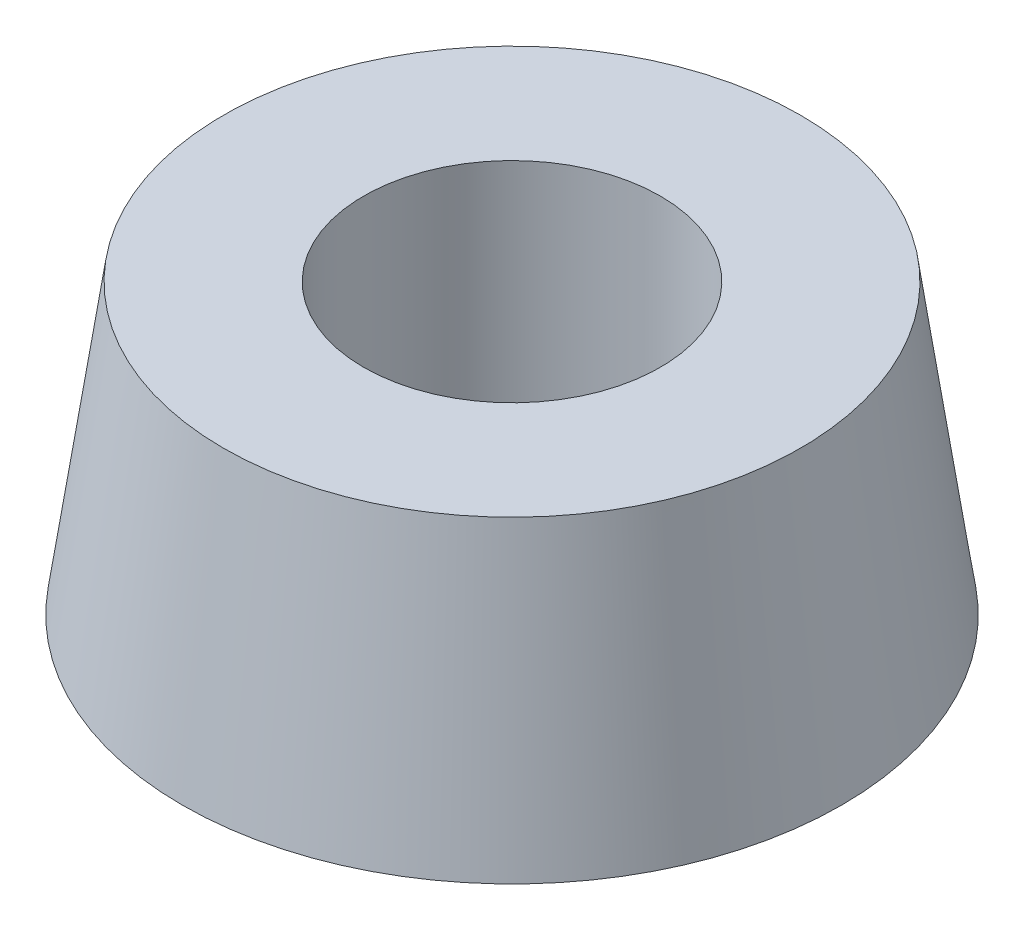
from build123d import *

# Parameters (mm, degrees)
SKETCH_1_R          = 12
SKETCH_2_R          = 10.5
SKETCH_4_R          = 5.4
CUT_EXTRUDE_1_DEPTH = 20.956202216


with BuildPart() as part:
    # 草图1 → 放样1 section 0
    with BuildSketch(Plane(origin=(0, 0, 0), x_dir=(1, 0, 0), z_dir=(0, 1, 0))):
        Circle(SKETCH_1_R)
    # 草图2 → 放样1 section 1
    with BuildSketch(Plane(origin=(0, 10.5, 0), x_dir=(1, 0, 0), z_dir=(0, 1, 0))):
        Circle(SKETCH_2_R)
    loft()

    # 草图4 → 切除-拉伸1 (cut, through all)
    with BuildSketch(Plane(origin=(0, 10.5, 0), x_dir=(1, 0, 0), z_dir=(0, 1, 0))):
        with Locations(Location((0, 0, 0), (0, 0, 270))):
            Circle(SKETCH_4_R)
    extrude(amount=-CUT_EXTRUDE_1_DEPTH, mode=Mode.SUBTRACT)


solid = part.part
